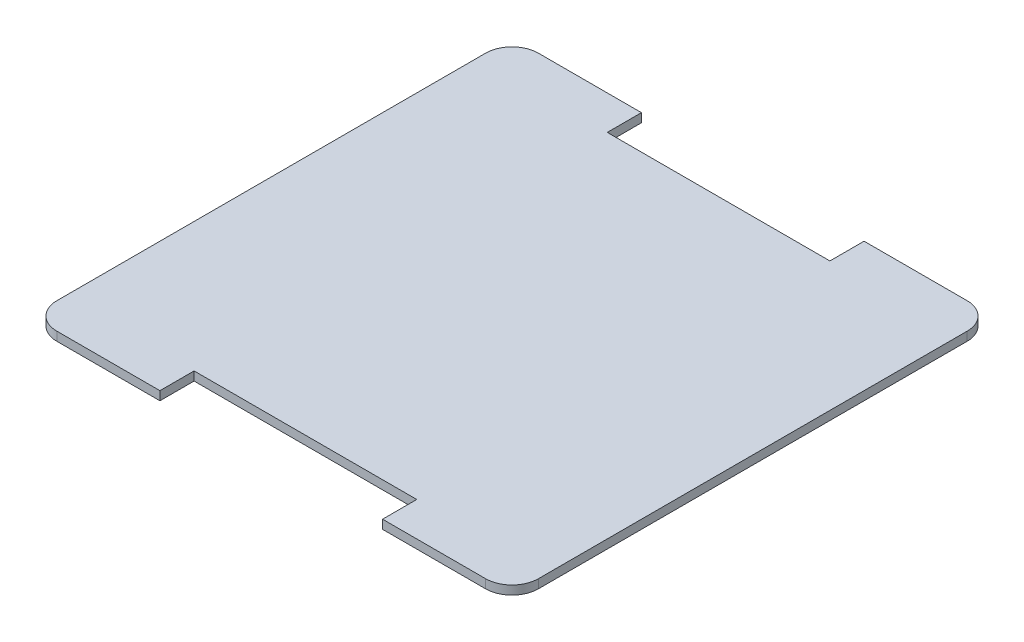
from build123d import *

# Parameters (mm, degrees)
SALIENTE_EXTRUIR1_DEPTH = 4


with BuildPart() as part:
    # Croquis1 → Saliente-Extruir1 (new, symmetric)
    with BuildSketch(Plane(origin=(0, 54.707138557, 0), x_dir=(1, 0, 0), z_dir=(0, 1, 0))):
        with BuildLine():
            Line((-153.357036721, -77.1), (49.152963279, -77.1))
            Line((49.152963279, -77.1), (49.152963279, -46.00446543))
            Line((49.152963279, -46.00446543), (142.897963279, -46.00446543))
            ThreePointArc((142.897963279, -46.00446543), (159.865368491, -53.032594788), (166.893497848, -70))
            Line((166.893497848, -70), (166.893497848, -460))
            ThreePointArc((166.893497848, -460), (159.865368491, -476.967405212), (142.897963279, -483.99553457))
            Line((142.897963279, -483.99553457), (49.152963279, -483.99553457))
            Line((49.152963279, -483.99553457), (49.152963279, -452.9))
            Line((49.152963279, -452.9), (-153.357036721, -452.9))
            Line((-153.357036721, -452.9), (-153.357036721, -483.99553457))
            Line((-153.357036721, -483.99553457), (-247.102036721, -483.99553457))
            ThreePointArc((-247.102036721, -483.99553457), (-264.069441934, -476.967405212), (-271.097571291, -460))
            Line((-271.097571291, -460), (-271.097571291, -70))
            ThreePointArc((-271.097571291, -70), (-264.069441934, -53.032594788), (-247.102036721, -46.00446543))
            Line((-247.102036721, -46.00446543), (-153.357036721, -46.00446543))
            Line((-153.357036721, -46.00446543), (-153.357036721, -77.1))
        make_face()
    extrude(amount=SALIENTE_EXTRUIR1_DEPTH, both=True)


solid = part.part
